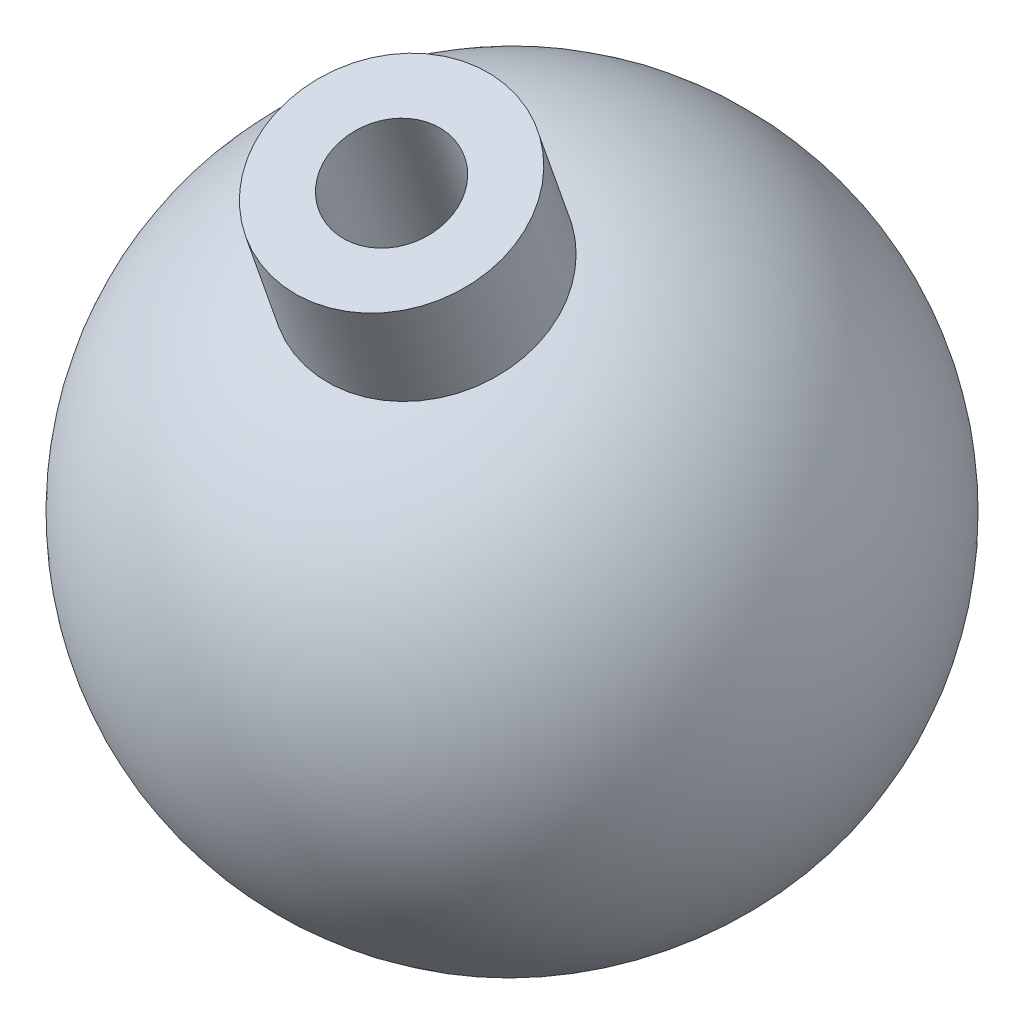
from build123d import *


with BuildPart() as part:
    # Ball socket turned profile → Turned socket body (revolve)
    with BuildSketch(Plane(origin=(0, -6.839373114, 16.171317762), x_dir=(-1, 0, 0), z_dir=(0, 0.3895270342980127, -0.9210150322068553)), mode=Mode.PRIVATE) as turned_socket_body_sk:
        with BuildLine():
            Line((21.450363513, -86.228362345), (21.288694752, -84.679417142))
            Line((21.288694752, -84.679417142), (22.034642647, -84.601559983))
            Line((22.034642647, -84.601559983), (22.283785554, -86.988593249))
            Line((22.283785554, -86.988593249), (23.02973345, -86.91073609))
            Line((23.02973345, -86.91073609), (23.060876313, -87.209115249))
            ThreePointArc((23.060876313, -87.209115249), (20.609484536, -88.906958963), (20.724096138, -91.886700412))
            Line((20.724096138, -91.886700412), (19.804272172, -93.020911066))
            ThreePointArc((19.804272172, -93.020911066), (19.009273884, -89.232523486), (21.450363513, -86.228362345))
        make_face()
    revolve(turned_socket_body_sk.sketch.rotate(Axis((-24.42078135, -99.160389667, -22.874224953), (0.10380954475082833, 0.9160389667138149, 0.3874224953206928)), 90), axis=Axis((-24.42078135, -99.160389667, -22.874224953), (0.10380954475082833, 0.9160389667138149, 0.3874224953206928)))


solid = part.part
